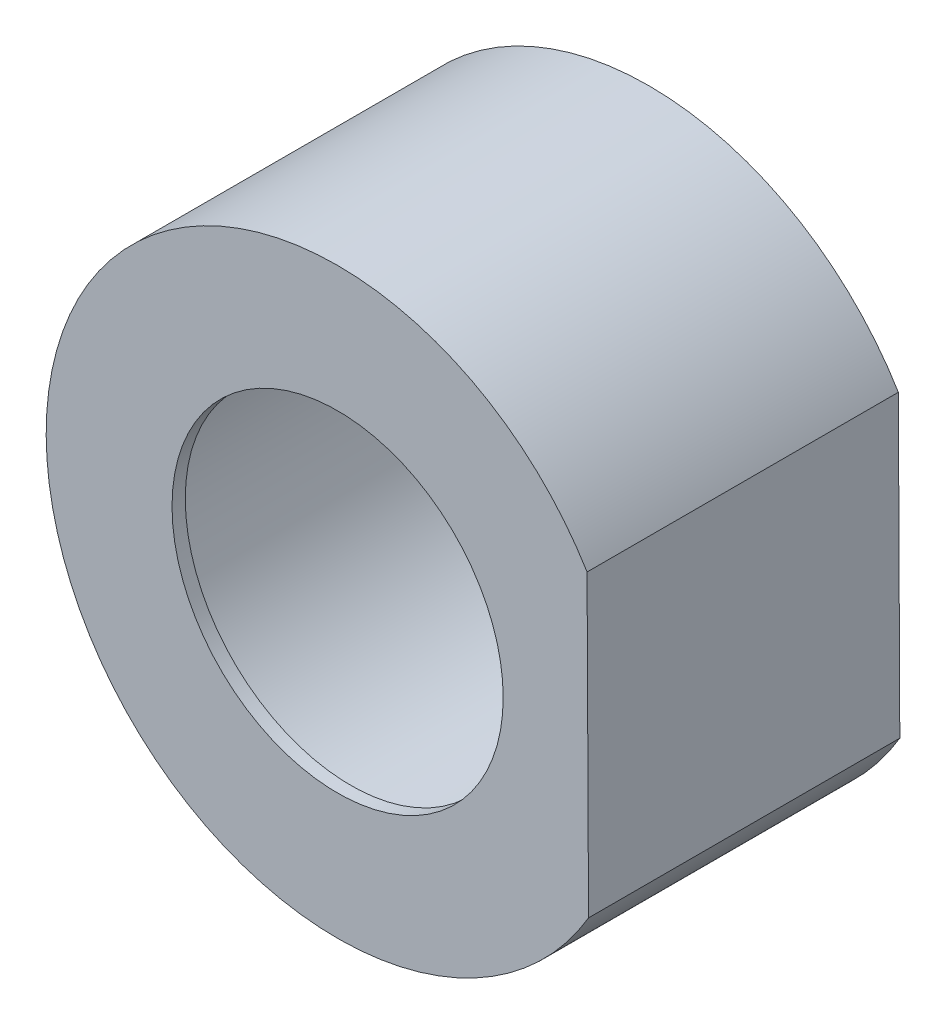
from build123d import *

# Parameters (mm, degrees)
EXTRUDE_1_DEPTH     = 23.5
SKETCH_6_R          = 16
CUT_EXTRUDE_8_DEPTH = 22.5
SKETCH_7_R          = 12.5
CUT_EXTRUDE_9_DEPTH = 39.395963329


with BuildPart() as part:
    # Эскиз1 → Вытянуть1 (new body)
    with BuildSketch(Plane.XY):
        with BuildLine():
            Line((18.943049375, -11.187532363), (18.832657697, 11.372378998))
            ThreePointArc((18.832657697, 11.372378998), (-21.99973662, -0.107650593), (18.943049375, -11.187532363))
        make_face()
    extrude(amount=EXTRUDE_1_DEPTH)

    # Эскиз6 → Вытянуть8 (cut)
    with BuildSketch(Plane(origin=(0, 0, 0), x_dir=(-1, 0, 0), z_dir=(0, 0, -1))):
        Circle(SKETCH_6_R)
    extrude(amount=-CUT_EXTRUDE_8_DEPTH, mode=Mode.SUBTRACT)

    # Эскиз7 → Вытянуть9 (cut, through all)
    with BuildSketch(Plane(origin=(0, 0, 22.5), x_dir=(-1, 0, 0), z_dir=(0, 0, -1))):
        Circle(SKETCH_7_R)
    extrude(amount=-CUT_EXTRUDE_9_DEPTH, mode=Mode.SUBTRACT)


solid = part.part
